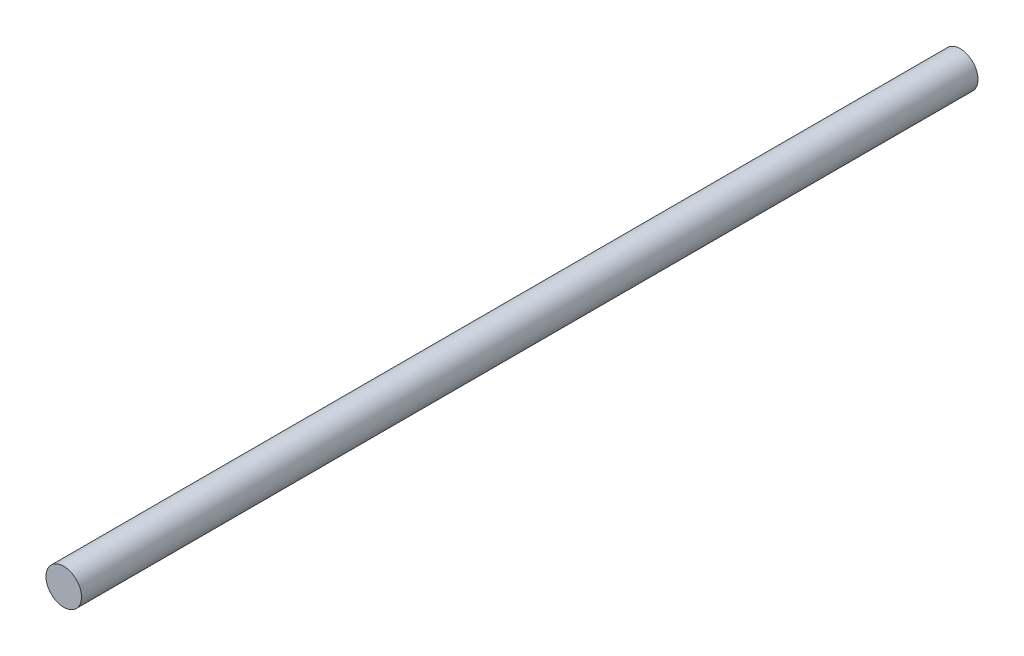
from build123d import *

# Parameters (mm, degrees)
SKETCH_1_R           = 3
CABLE_ENVELOPE_DEPTH = 151.3


with BuildPart() as part:
    # 草图1 → Cable_envelope (new body)
    with BuildSketch(Plane.XY):
        Circle(SKETCH_1_R)
    extrude(amount=CABLE_ENVELOPE_DEPTH)


solid = part.part
